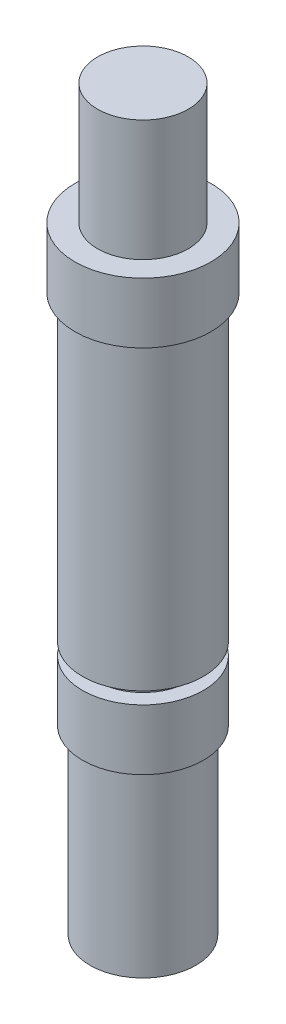
from build123d import *

# Parameters (mm, degrees)
SKETCH_1_R      = 17.5
EXTRUDE_1_DEPTH = 60
SKETCH_2_R      = 20
EXTRUDE_2_DEPTH = 20
SKETCH_3_R      = 15
EXTRUDE_3_DEPTH = 4
SKETCH_4_R      = 20
EXTRUDE_4_DEPTH = 100
SKETCH_5_R      = 22.5
EXTRUDE_5_DEPTH = 20
SKETCH_6_R      = 15
EXTRUDE_6_DEPTH = 40


with BuildPart() as part:
    # 草图1 → 凸台-拉伸1 (new body)
    with BuildSketch(Plane(origin=(0, 0, 0), x_dir=(1, 0, 0), z_dir=(0, 1, 0))):
        with Locations(Location((0, 0, 0), (0, 0, 270))):
            Circle(SKETCH_1_R)
    extrude(amount=EXTRUDE_1_DEPTH)

    # 草图2 → 凸台-拉伸2 (add)
    with BuildSketch(Plane(origin=(0, 60, 0), x_dir=(1, 0, 0), z_dir=(0, 1, 0))):
        with Locations(Location((0, 0, 0), (0, 0, 270))):
            Circle(SKETCH_2_R)
    extrude(amount=EXTRUDE_2_DEPTH)

    # 草图3 → 凸台-拉伸3 (add)
    with BuildSketch(Plane(origin=(0, 80, 0), x_dir=(1, 0, 0), z_dir=(0, 1, 0))):
        with Locations(Location((0, 0, 0), (0, 0, 270))):
            Circle(SKETCH_3_R)
    extrude(amount=EXTRUDE_3_DEPTH)

    # 草图4 → 凸台-拉伸4 (add)
    with BuildSketch(Plane(origin=(0, 84, 0), x_dir=(1, 0, 0), z_dir=(0, 1, 0))):
        with Locations(Location((0, 0, 0), (0, 0, 270))):
            Circle(SKETCH_4_R)
    extrude(amount=EXTRUDE_4_DEPTH)

    # 草图5 → 凸台-拉伸5 (add)
    with BuildSketch(Plane(origin=(0, 184, 0), x_dir=(1, 0, 0), z_dir=(0, 1, 0))):
        with Locations(Location((0, 0, 0), (0, 0, 270))):
            Circle(SKETCH_5_R)
    extrude(amount=EXTRUDE_5_DEPTH)

    # 草图6 → 凸台-拉伸6 (add)
    with BuildSketch(Plane(origin=(0, 204, 0), x_dir=(1, 0, 0), z_dir=(0, 1, 0))):
        with Locations(Location((0, 0, 0), (0, 0, 270))):
            Circle(SKETCH_6_R)
    extrude(amount=EXTRUDE_6_DEPTH)


solid = part.part
